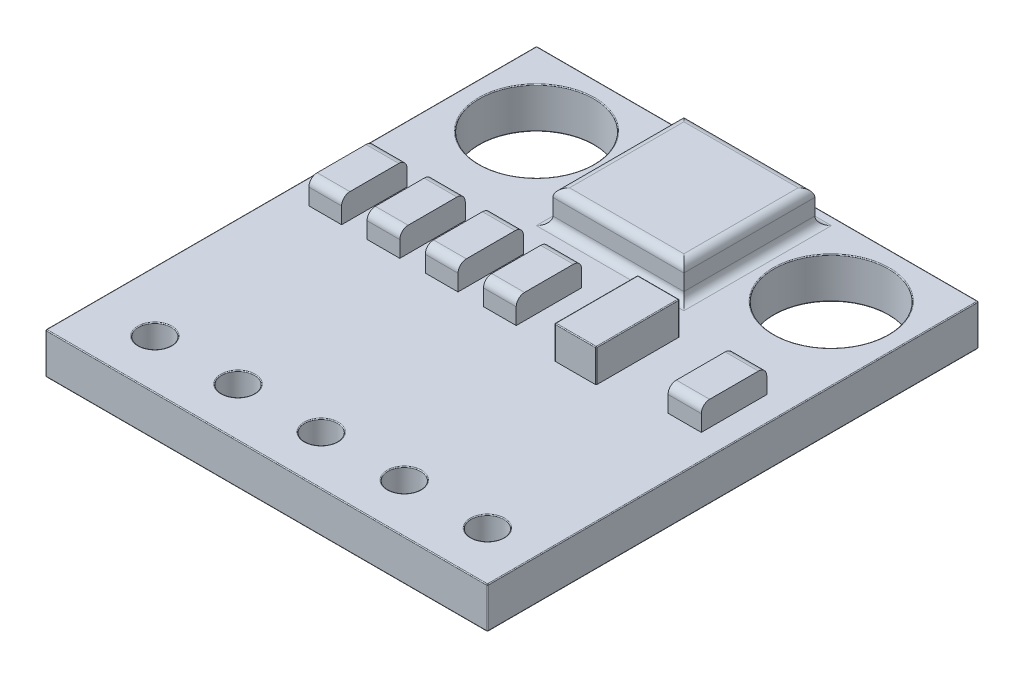
from build123d import *

# Parameters (mm, degrees)
SKETCH1_W           = 13.5
SKETCH1_H           = 14.999999972
BOSS_EXTRUDE1_DEPTH = 1.25
SKETCH2_W           = 4
SKETCH2_H           = 4
BOSS_EXTRUDE2_DEPTH = 1
SKETCH3_R           = 1.750000056
CUT_EXTRUDE1_DEPTH  = 25.4
SKETCH4_W           = 1
SKETCH4_H           = 2
SKETCH4_W_2         = 1.016
BOSS_EXTRUDE4_DEPTH = 0.75
SKETCH5_W           = 1.27
SKETCH5_H           = 2.54
BOSS_EXTRUDE5_DEPTH = 1
SKETCH6_R           = 0.5
CUT_EXTRUDE2_DEPTH  = 25.4
FILLET1_R           = 0.0254
FILLET2_R           = 0.0254
FILLET3_R           = 0.254
FILLET4_R           = 0.254
FILLET5_R           = 0.0254
FILLET6_R           = 0.0254


with BuildPart() as part:
    # Sketch1 → Boss-Extrude1 (new body)
    with BuildSketch(Plane(origin=(0, 0, 0), x_dir=(1, 0, 0), z_dir=(0, 1, 0))):
        with Locations((6.75, 7.499999986)):
            Rectangle(SKETCH1_W, SKETCH1_H)
    extrude(amount=BOSS_EXTRUDE1_DEPTH)

    # Sketch2 → Boss-Extrude2 (add)
    with BuildSketch(Plane(origin=(0, 1.25, 0), x_dir=(1, 0, 0), z_dir=(0, 1, 0))):
        with Locations((7, 12.499999972)):
            Rectangle(SKETCH2_W, SKETCH2_H)
    extrude(amount=BOSS_EXTRUDE2_DEPTH)

    # Sketch3 → Cut-Extrude1 (cut)
    with BuildSketch(Plane(origin=(0, 1.25, 0), x_dir=(1, 0, 0), z_dir=(0, 1, 0))):
        with Locations(Location((11.249999928, 12.749999972, 0), (0, 0, 270))):
            Circle(SKETCH3_R)
        with Locations(Location((2.25, 12.749999972, 0), (0, 0, 270))):
            Circle(SKETCH3_R)
    extrude(amount=-CUT_EXTRUDE1_DEPTH, mode=Mode.SUBTRACT)

    # Sketch4 → Boss-Extrude4 (add)
    with BuildSketch(Plane(origin=(0, 1.25, 0), x_dir=(1, 0, 0), z_dir=(0, 1, 0))):
        with Locations((1.25, 8.294706363)):
            Rectangle(SKETCH4_W, SKETCH4_H)
        with Locations((3.028, 8.294706363)):
            Rectangle(SKETCH4_W, SKETCH4_H)
        with Locations((4.806, 8.294706363)):
            Rectangle(SKETCH4_W, SKETCH4_H)
        with Locations((6.584, 8.294706363)):
            Rectangle(SKETCH4_W, SKETCH4_H)
        with Locations((12.23, 8.294706363)):
            Rectangle(SKETCH4_W_2, SKETCH4_H)
    extrude(amount=BOSS_EXTRUDE4_DEPTH)

    # Sketch5 → Boss-Extrude5 (add)
    with BuildSketch(Plane(origin=(0, 1.25, 0), x_dir=(1, 0, 0), z_dir=(0, 1, 0))):
        with Locations((9.243, 8.213557621)):
            Rectangle(SKETCH5_W, SKETCH5_H)
    extrude(amount=BOSS_EXTRUDE5_DEPTH)

    # Sketch6 → Cut-Extrude2 (cut)
    with BuildSketch(Plane(origin=(0, 1.25, 0), x_dir=(1, 0, 0), z_dir=(0, 1, 0))):
        with Locations(Location((12, 1.5, 0), (0, 0, 270))):
            Circle(SKETCH6_R)
        with Locations(Location((9.46, 1.5, 0), (0, 0, 270))):
            Circle(SKETCH6_R)
        with Locations(Location((6.92, 1.5, 0), (0, 0, 270))):
            Circle(SKETCH6_R)
        with Locations(Location((4.38, 1.5, 0), (0, 0, 270))):
            Circle(SKETCH6_R)
        with Locations(Location((1.84, 1.5, 0), (0, 0, 270))):
            Circle(SKETCH6_R)
    extrude(amount=-CUT_EXTRUDE2_DEPTH, mode=Mode.SUBTRACT)

    # Fillet1
    fillet1_edges = [part.edges().sort_by_distance(p)[0] for p in [
        (11.249999928, 0, -14.500000028),
        (11.249999928, 1.25, -14.500000028),
        (2.25, 0, -14.500000028),
        (2.25, 1.25, -14.500000028),
    ]]
    fillet(fillet1_edges, radius=FILLET1_R)

    # Fillet2
    fillet2_edges = [part.edges().sort_by_distance(p)[0] for p in [
        (12, 0, -2),
        (12, 1.25, -2),
        (9.46, 0, -2),
        (9.46, 1.25, -2),
        (6.92, 0, -2),
        (6.92, 1.25, -2),
        (4.38, 0, -2),
        (4.38, 1.25, -2),
        (1.84, 0, -2),
        (1.84, 1.25, -2),
    ]]
    fillet(fillet2_edges, radius=FILLET2_R)

    # Fillet3
    fillet3_edges = [part.edges().sort_by_distance(p)[0] for p in [
        (1.25, 2, -7.294706363),
        (1.25, 2, -9.294706363),
        (12.23, 2, -7.294706363),
        (12.23, 2, -9.294706363),
        (3.028, 2, -7.294706363),
        (3.028, 2, -9.294706363),
        (4.806, 2, -7.294706363),
        (4.806, 2, -9.294706363),
        (6.584, 2, -7.294706363),
        (6.584, 2, -9.294706363),
    ]]
    fillet(fillet3_edges, radius=FILLET3_R)

    # Fillet4
    fillet4_edges = [part.edges().sort_by_distance(p)[0] for p in [
        (5, 1.25, -12.499999972),
        (7, 1.25, -10.499999972),
        (9, 1.25, -12.499999972),
        (7, 1.25, -14.499999972),
        (5, 2.25, -12.499999972),
        (7, 2.25, -10.499999972),
        (9, 2.25, -12.499999972),
        (7, 2.25, -14.499999972),
    ]]
    fillet(fillet4_edges, radius=FILLET4_R)

    # Fillet5
    fillet5_edges = [part.edges().sort_by_distance(p)[0] for p in [
        (8.608, 1.75, -9.483557621),
        (8.608, 1.75, -6.943557621),
        (9.878, 1.75, -6.943557621),
        (9.878, 1.75, -9.483557621),
        (8.608, 2.25, -8.213557621),
        (9.243, 2.25, -6.943557621),
        (9.878, 2.25, -8.213557621),
        (9.243, 2.25, -9.483557621),
    ]]
    fillet(fillet5_edges, radius=FILLET5_R)

    # Fillet6
    fillet6_edges = [part.edges().sort_by_distance(p)[0] for p in [
        (13.5, 1.25, -7.499999986),
        (6.75, 1.25, -14.999999972),
        (0, 1.25, -7.499999986),
        (6.75, 0, -14.999999972),
        (13.5, 0, -7.499999986),
        (6.75, 0, 0),
        (0, 0, -7.499999986),
        (6.75, 1.25, 0),
        (0, 0.625, -14.999999972),
        (13.5, 0.625, -14.999999972),
        (13.5, 0.625, 0),
        (0, 0.625, 0),
    ]]
    fillet(fillet6_edges, radius=FILLET6_R)


solid = part.part
